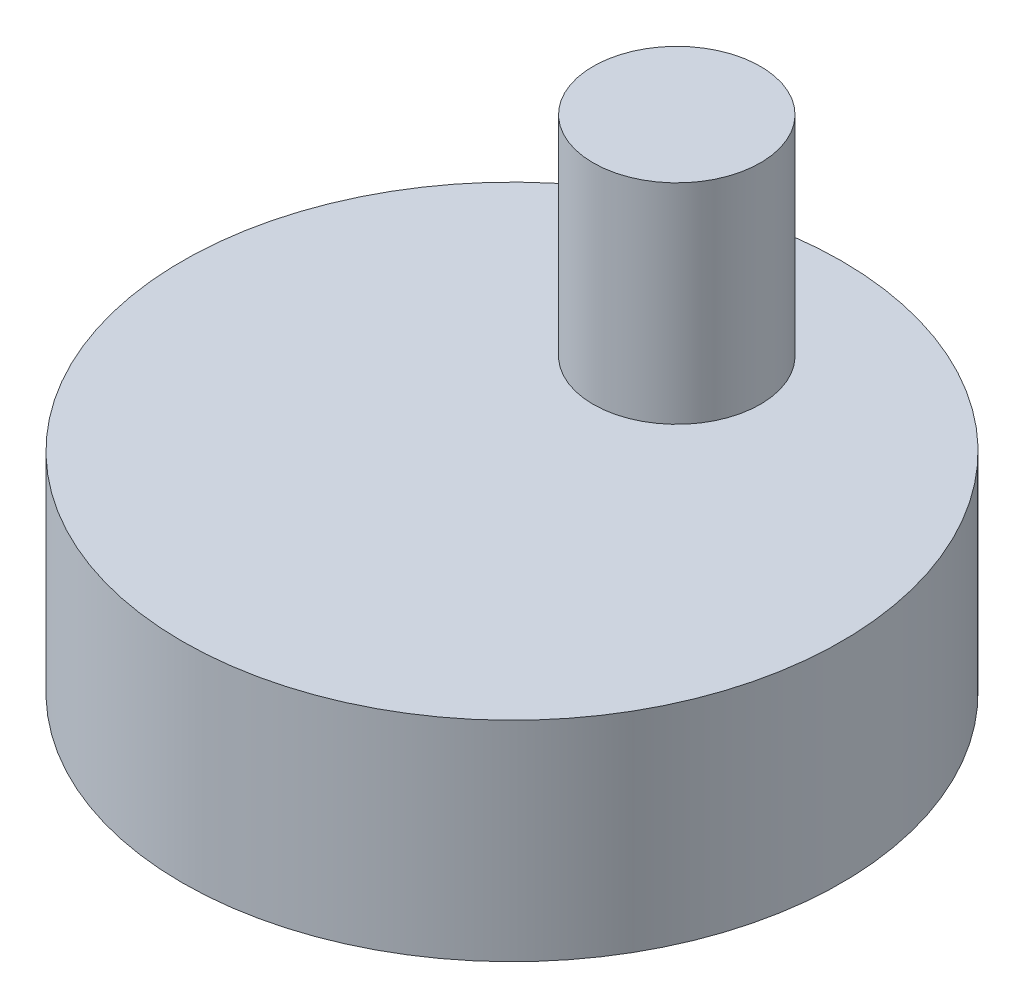
from build123d import *

# Parameters (mm, degrees)
SKETCH1_R           = 7.88
BOSS_EXTRUDE1_DEPTH = 5
SKETCH1_3_R         = 2
BOSS_EXTRUDE2_DEPTH = 10


with BuildPart() as part:
    # Sketch1 → Boss-Extrude1 (new body)
    with BuildSketch(Plane(origin=(0, 0, 0), x_dir=(1, 0, 0), z_dir=(0, 1, 0))):
        Circle(SKETCH1_R)
    extrude(amount=BOSS_EXTRUDE1_DEPTH)

    # Sketch1<3> → Boss-Extrude2 (add)
    with BuildSketch(Plane(origin=(0, 0, 0), x_dir=(1, 0, 0), z_dir=(0, 1, 0))):
        with Locations((0, 3.94)):
            Circle(SKETCH1_3_R)
    extrude(amount=BOSS_EXTRUDE2_DEPTH)


solid = part.part
